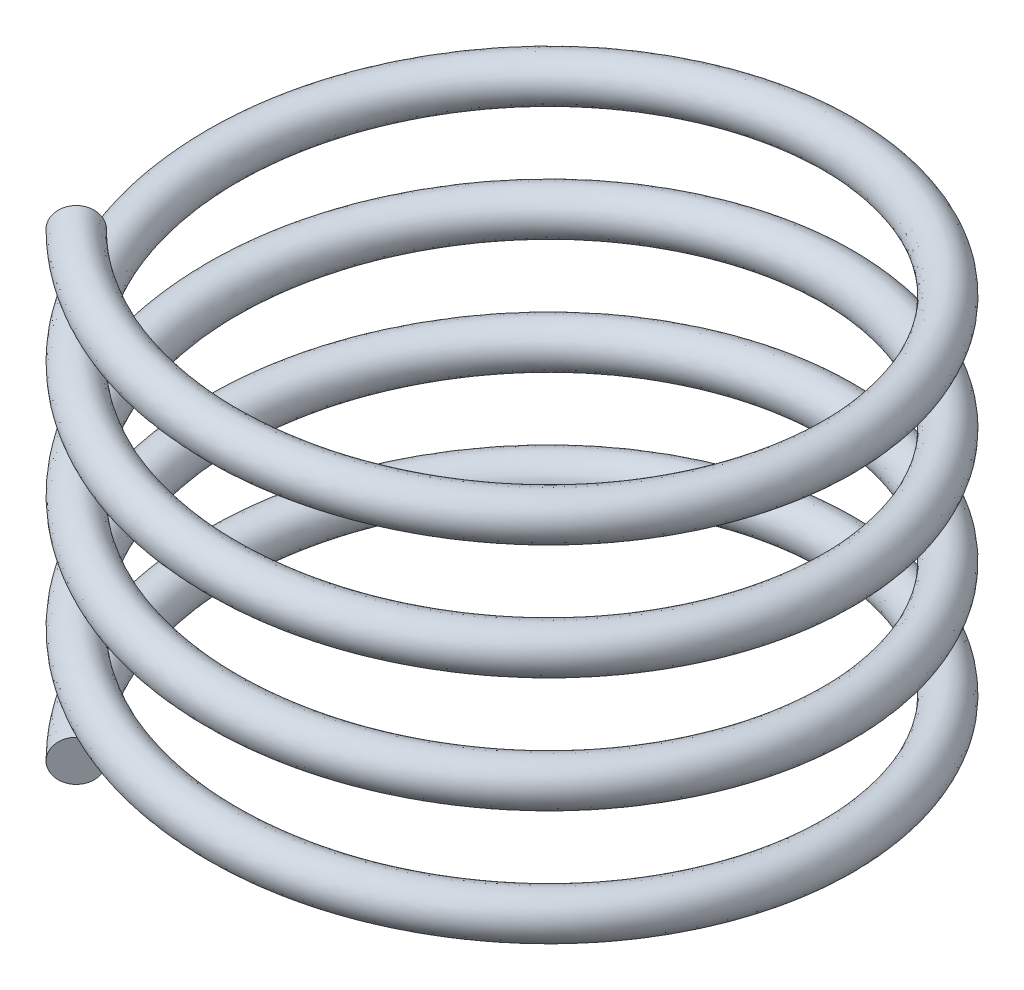
from build123d import *

# Parameters (mm, degrees)
SWEEP1_PITCH       = 1.75
SWEEP1_HEIGHT      = 7
SWEEP1_RADIUS      = 4.675
SWEEP1_START_ANGLE = -45
SKETCH4_R          = 0.325


with BuildPart() as part:
    # Sweep1: sweep along a helix
    with BuildLine() as sweep1_path:
        add(Helix(SWEEP1_PITCH, SWEEP1_HEIGHT, SWEEP1_RADIUS, center=(0, 0, 0), direction=(0, 1, 0), lefthand=True, mode=Mode.PRIVATE).rotate(Axis((0, 0, 0), (0, 1, 0)), SWEEP1_START_ANGLE))
    # Sketch4 → Sweep1 (sweep)
    with BuildSketch(Plane(origin=(-3.305724202, 0, 3.305724202), x_dir=(-0.6992342288358347, 0.10090366546936343, 0.7077357865186713), z_dir=(-0.7058552147604303, 0.059471266936546655, -0.7058552147604131))):
        with Locations((0.00928562, 0.003561064)):
            Circle(SKETCH4_R)
    sweep(path=sweep1_path.line, is_frenet=True)


solid = part.part
